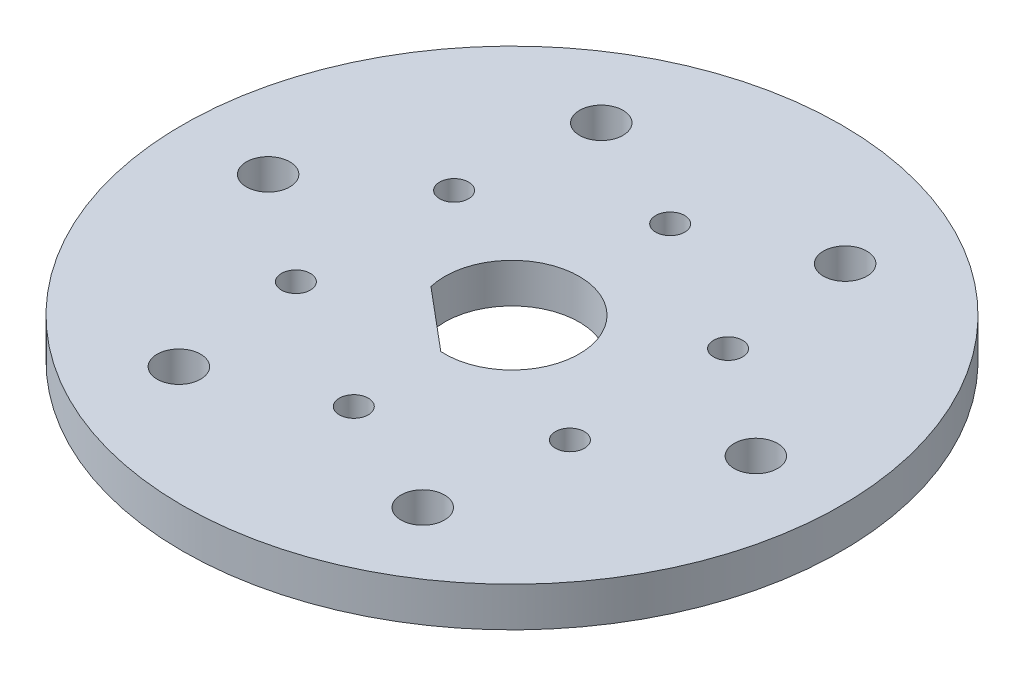
from build123d import *

# Parameters (mm, degrees)
SKETCH_1_R      = 25
SKETCH_1_R_2    = 1.1
SKETCH_1_R_3    = 1.65
EXTRUDE_1_DEPTH = 3


with BuildPart() as part:
    # 草图1 → 凸台-拉伸1 (new body)
    with BuildSketch(Plane(origin=(0, 0, 0), x_dir=(1, 0, 0), z_dir=(0, 1, 0))):
        with Locations(Location((0, 0, 0), (0, 0, 270))):
            Circle(SKETCH_1_R)
        with Locations(Location((0, 12, 0), (0, 0, 270))):
            Circle(SKETCH_1_R_2, mode=Mode.SUBTRACT)
        with Locations(Location((-9.25, 16.02146997, 0), (0, 0, 270))):
            Circle(SKETCH_1_R_3, mode=Mode.SUBTRACT)
        with Locations(Location((9.25, 16.02146997, 0), (0, 0, 270))):
            Circle(SKETCH_1_R_3, mode=Mode.SUBTRACT)
        with Locations(Location((10.392304845, 6, 0), (0, 0, 270))):
            Circle(SKETCH_1_R_2, mode=Mode.SUBTRACT)
        with Locations(Location((18.5, 0, 0), (0, 0, 270))):
            Circle(SKETCH_1_R_3, mode=Mode.SUBTRACT)
        with Locations(Location((10.392304845, -6, 0), (0, 0, 270))):
            Circle(SKETCH_1_R_2, mode=Mode.SUBTRACT)
        with Locations(Location((9.25, -16.02146997, 0), (0, 0, 270))):
            Circle(SKETCH_1_R_3, mode=Mode.SUBTRACT)
        with Locations(Location((0, -12, 0), (0, 0, 270))):
            Circle(SKETCH_1_R_2, mode=Mode.SUBTRACT)
        with Locations(Location((-9.25, -16.02146997, 0), (0, 0, 270))):
            Circle(SKETCH_1_R_3, mode=Mode.SUBTRACT)
        with Locations(Location((-10.392304845, -6, 0), (0, 0, 270))):
            Circle(SKETCH_1_R_2, mode=Mode.SUBTRACT)
        with Locations(Location((-18.5, 0, 0), (0, 0, 270))):
            Circle(SKETCH_1_R_3, mode=Mode.SUBTRACT)
        with Locations(Location((-10.392304845, 6, 0), (0, 0, 270))):
            Circle(SKETCH_1_R_2, mode=Mode.SUBTRACT)
        with BuildLine():
            Line((-4.958957038, -1.191110864), (-0.311901361, -5.090453569))
            ThreePointArc((-0.311901361, -5.090453569), (3.278216809, 3.90682666), (-4.958957038, -1.191110864))
        make_face(mode=Mode.SUBTRACT)
    extrude(amount=EXTRUDE_1_DEPTH)


solid = part.part
